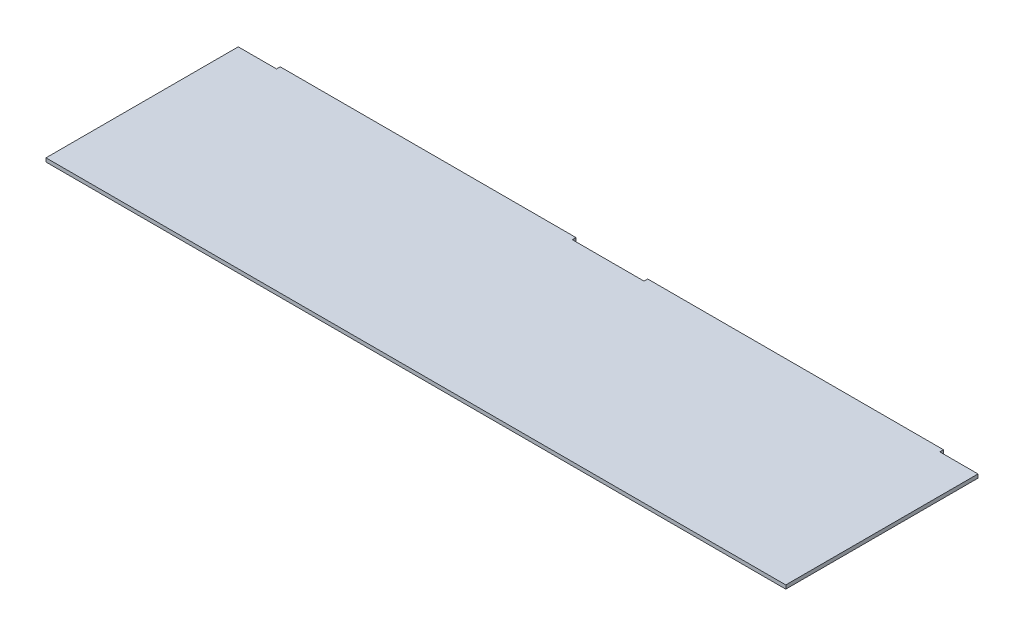
from build123d import *

# Parameters (mm, degrees)
SKETCH1_W           = 635.3556
SKETCH1_H           = 165.1
BOSS_EXTRUDE1_DEPTH = 1.5875
SKETCH2_W           = 254
SKETCH2_H           = 3.175
BOSS_EXTRUDE2_DEPTH = 3.175


with BuildPart() as part:
    # Sketch1 → Boss-Extrude1 (new, symmetric)
    with BuildSketch(Plane(origin=(0, 0, 0), x_dir=(1, 0, 0), z_dir=(0, 1, 0))):
        Rectangle(SKETCH1_W, SKETCH1_H)
    extrude(amount=BOSS_EXTRUDE1_DEPTH, both=True)

    # Sketch2 → Boss-Extrude2 (add)
    with BuildSketch(Plane(origin=(0, 0, -82.55), x_dir=(-1, 0, 0), z_dir=(0, 0, -1))):
        with Locations((-157.8229, 0)):
            Rectangle(SKETCH2_W, SKETCH2_H)
        with Locations((157.8229, 0)):
            Rectangle(SKETCH2_W, SKETCH2_H)
    extrude(amount=BOSS_EXTRUDE2_DEPTH)


solid = part.part
